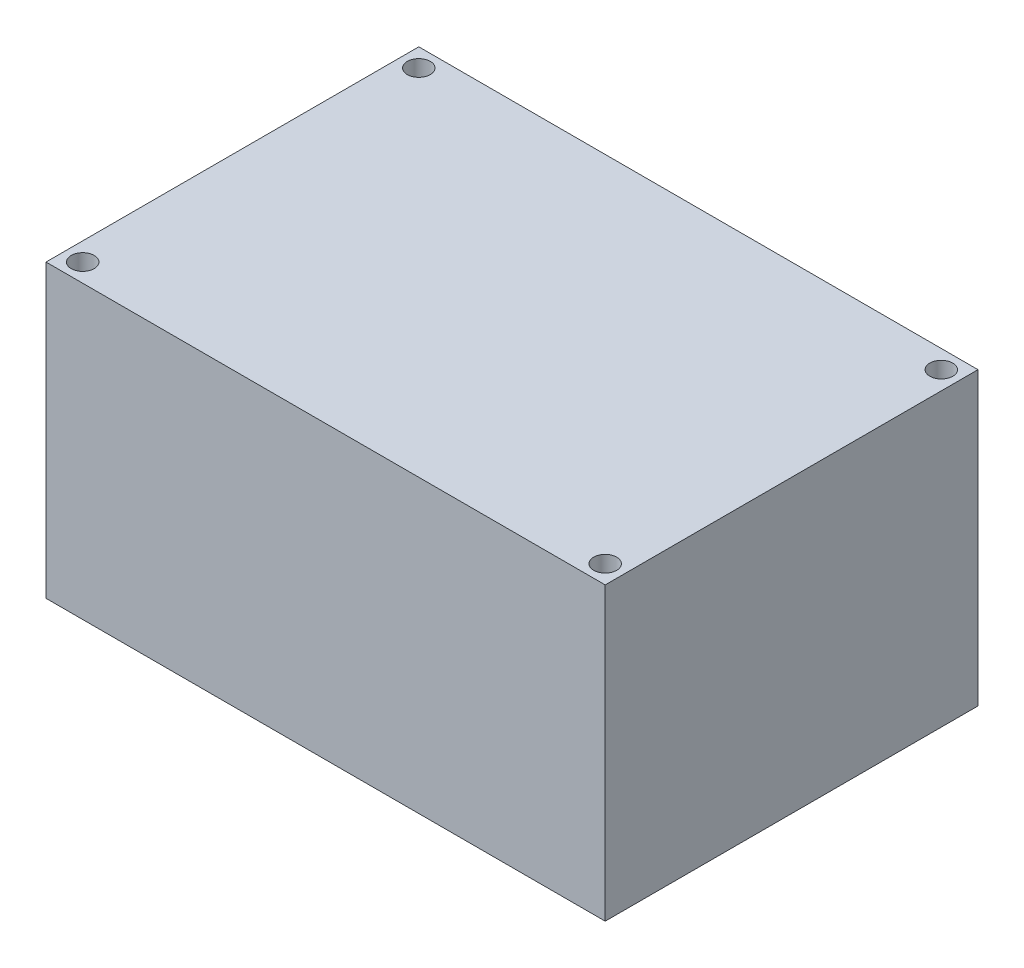
from build123d import *

# Parameters (mm, degrees)
SKETCH1_W           = 60.96
SKETCH1_H           = 40.64
BOSS_EXTRUDE1_DEPTH = 31.75
SKETCH3_R           = 1.251959024
SKETCH3_R_2         = 1.252496279
SKETCH3_R_3         = 1.25
SKETCH3_R_4         = 1.249249958
CUT_EXTRUDE1_DEPTH  = 80.848567301


with BuildPart() as part:
    # Sketch1 → Boss-Extrude1 (new body)
    with BuildSketch(Plane(origin=(0, 0, 0), x_dir=(1, 0, 0), z_dir=(0, 1, 0))):
        with Locations((-30.48, 20.32)):
            Rectangle(SKETCH1_W, SKETCH1_H)
    extrude(amount=BOSS_EXTRUDE1_DEPTH)

    # Sketch3 → Cut-Extrude1 (cut, through all)
    with BuildSketch(Plane(origin=(0, 31.75, 0), x_dir=(1, 0, 0), z_dir=(0, 1, 0))):
        with Locations(Location((-58.96, 2, 0), (0, 0, 270))):
            Circle(SKETCH3_R)
        with Locations(Location((-58.96, 38.64, 0), (0, 0, 270))):
            Circle(SKETCH3_R_2)
        with Locations(Location((-1.999712025, 38.64, 0), (0, 0, 270))):
            Circle(SKETCH3_R_3)
        with Locations(Location((-1.999712025, 2, 0), (0, 0, 270))):
            Circle(SKETCH3_R_4)
    extrude(amount=-CUT_EXTRUDE1_DEPTH, mode=Mode.SUBTRACT)


solid = part.part
